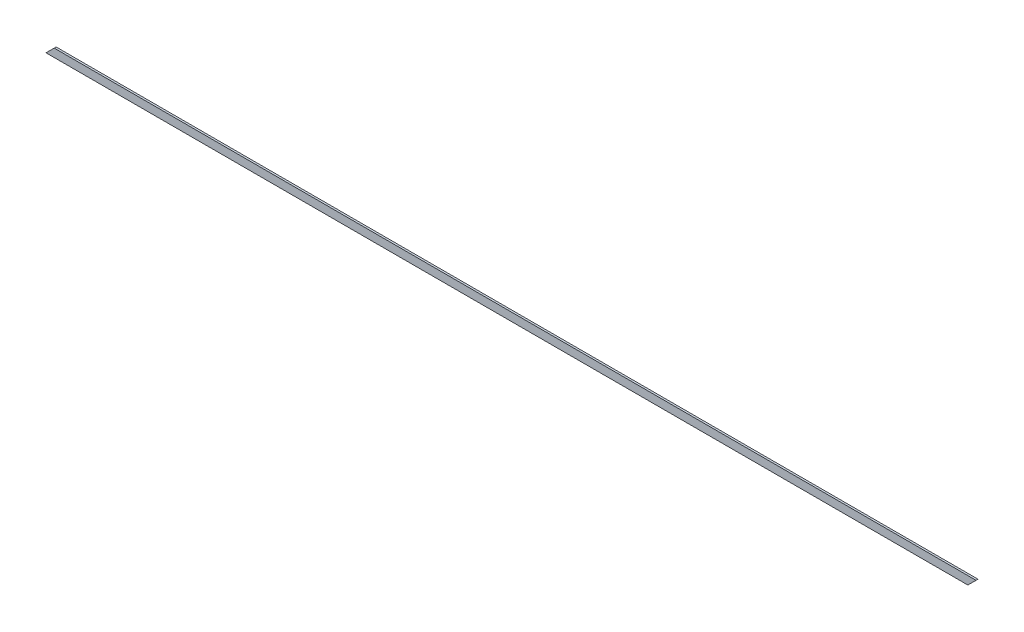
from build123d import *

# Parameters (mm, degrees)
BOSS_EXTRUDE3_DEPTH = 63.5


with BuildPart() as part:
    # Sketch4 → Boss-Extrude3 (new body)
    with BuildSketch(Plane.XY):
        Polygon((0, 0), (30000, 0), (30266.699999912, 266.699999912), (266.699999912, 266.699999912), align=None)
    extrude(amount=BOSS_EXTRUDE3_DEPTH)


solid = part.part
